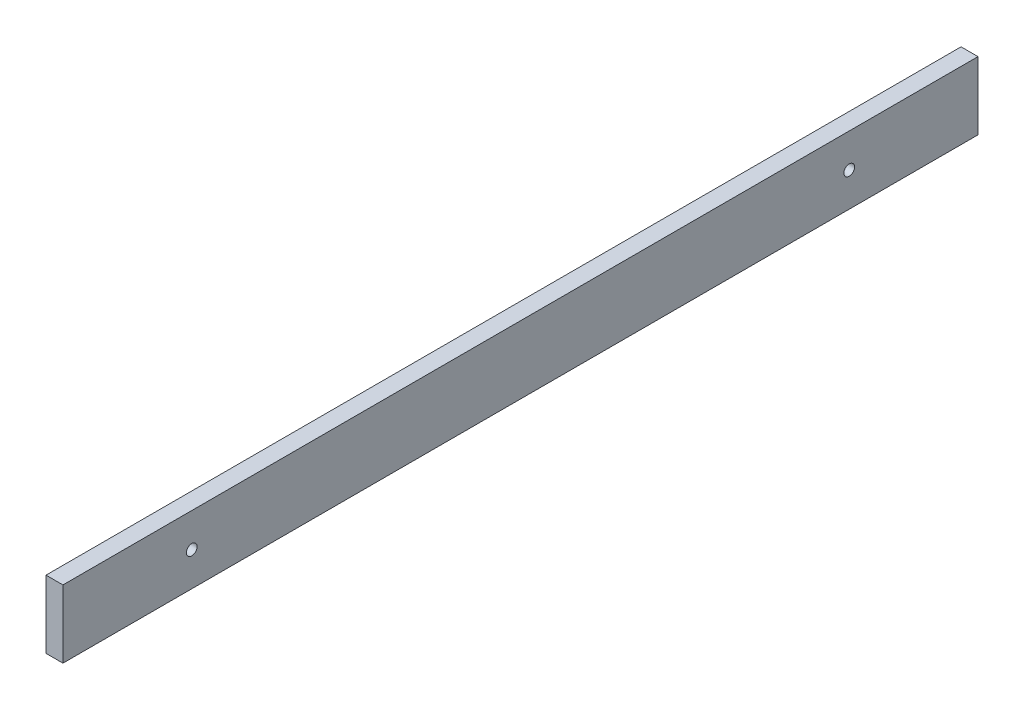
from build123d import *

# Parameters (mm, degrees)
CROQUIS1_W              = 270
CROQUIS1_H              = 20
CROQUIS1_R              = 1.58
SALIENTE_EXTRUIR1_DEPTH = 5


with BuildPart() as part:
    # Croquis1 → Saliente-Extruir1 (new body)
    with BuildSketch(Plane(origin=(0, 0, 0), x_dir=(0, 0, -1), z_dir=(1, 0, 0))):
        Rectangle(CROQUIS1_W, CROQUIS1_H)
        with Locations((97, 0)):
            Circle(CROQUIS1_R, mode=Mode.SUBTRACT)
        with Locations((-97, 0)):
            Circle(CROQUIS1_R, mode=Mode.SUBTRACT)
    extrude(amount=SALIENTE_EXTRUIR1_DEPTH)


solid = part.part
